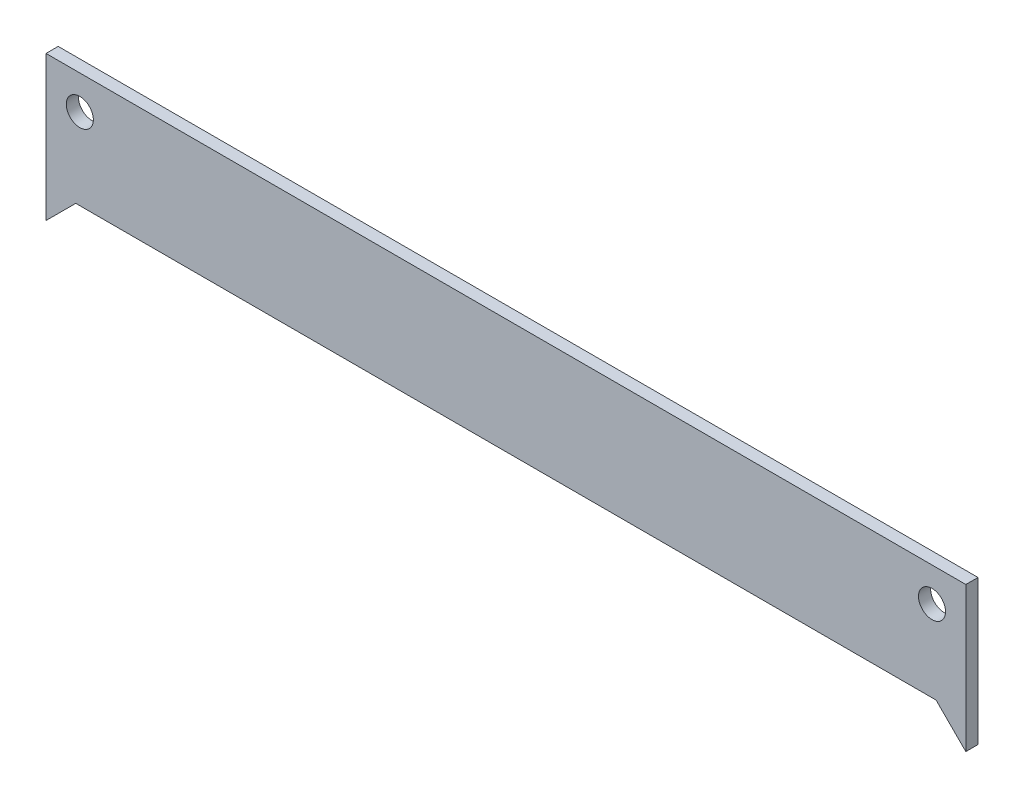
from build123d import *

# Parameters (mm, degrees)
CROQUIS1_R              = 1
SALIENTE_EXTRUIR1_DEPTH = 0.9


with BuildPart() as part:
    # Croquis1 → Saliente-Extruir1 (new body)
    with BuildSketch(Plane.XY):
        Polygon((-49.143678161, 1.367816092), (-49.143678161, -0.832183908), (-46.943678161, 1.367816092), (16.656321839, 1.367816092), (18.856321839, -0.832183908), (18.856321839, 1.367816092), (18.856321839, 9.867816092), (-49.143678161, 9.867816092), align=None)
        with Locations((-46.643678161, 7.367816092)):
            Circle(CROQUIS1_R, mode=Mode.SUBTRACT)
        with Locations((16.356321839, 7.367816092)):
            Circle(CROQUIS1_R, mode=Mode.SUBTRACT)
    extrude(amount=SALIENTE_EXTRUIR1_DEPTH)


solid = part.part
